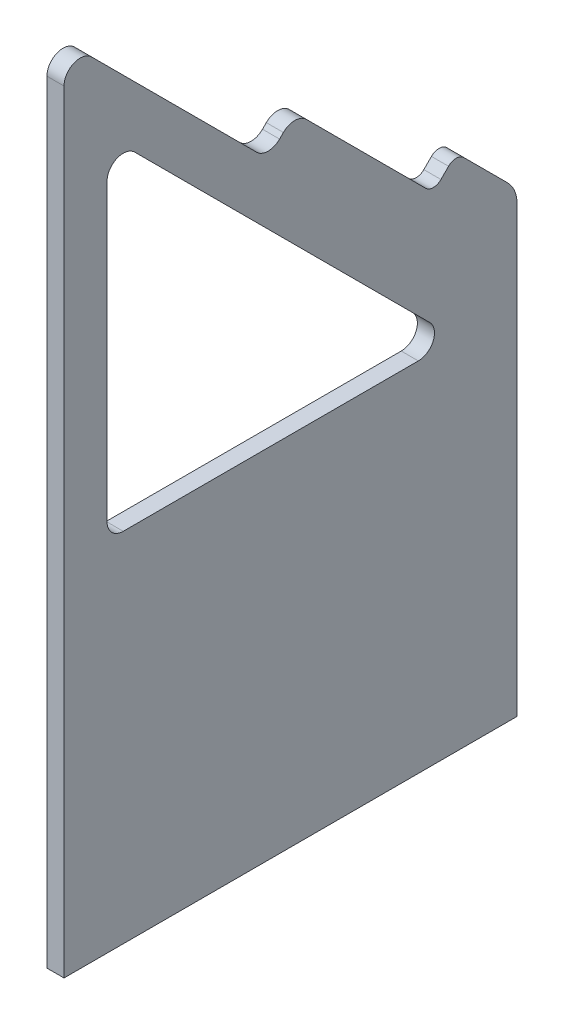
from build123d import *

# Parameters (mm, degrees)
BOSS_EXTRU_1_DEPTH      = 3.175
CONG_1_R                = 6
CONG_2_R                = 2
ENL_V_MAT_EXTRU_2_DEPTH = 157.50531659973907
CONG_4_R                = 3
BOSS_EXTRU_2_DEPTH      = 3.175
CONG_5_R                = 2
CONG_6_R                = 3


with BuildPart() as part:
    # Esquisse1 → Boss.-Extru.1 (new body)
    with BuildSketch(Plane(origin=(0, 0, 0), x_dir=(0, 0, -1), z_dir=(1, 0, 0))):
        Polygon((-42.0728534805994, 0), (42.0728534805994, 0), (42.072853480599385, 84.94974746830529), (30.759144981614714, 96.26345596728963), (26.516504294495412, 92.02081528017037), (33.58757210636085, 84.94974746830486), (28.637824638054987, 79.99999999999906), (-42.07285348059938, 150.71067811865416), align=None)
    extrude(amount=BOSS_EXTRU_1_DEPTH)

    # Congé1
    cong_1_edges = [part.edges().sort_by_distance(p)[0] for p in [
        (1.5875, 84.94974746830529, -42.072853480599385),
    ]]
    fillet(cong_1_edges, radius=CONG_1_R)

    # Congé2
    cong_2_edges = [part.edges().sort_by_distance(p)[0] for p in [
        (1.5875, 92.02081528017037, -26.516504294495412),
        (1.5875, 96.26345596728963, -30.759144981614714),
    ]]
    fillet(cong_2_edges, radius=CONG_2_R)

    # Esquisse4 → Enlèv. mat.-Extru.2 (cut, through all)
    with BuildSketch(Plane(origin=(3.175, 0, 0), x_dir=(0, 0, -1), z_dir=(1, 0, 0))):
        Polygon((30.974116139400625, 66.34999999966868), (-34.07285348059938, 66.34999999966868), (-34.07285348059938, 131.39696961966868), align=None)
    extrude(amount=-ENL_V_MAT_EXTRU_2_DEPTH, mode=Mode.SUBTRACT)

    # Congé4
    cong_4_edges = [part.edges().sort_by_distance(p)[0] for p in [
        (1.5875, 150.71067811865416, 42.07285348059938),
        (1.5875, 131.39696961966868, 34.07285348059938),
        (1.5875, 66.34999999966868, -30.974116139400625),
        (1.5875, 66.34999999966868, 34.07285348059938),
    ]]
    fillet(cong_4_edges, radius=CONG_4_R)

    # Esquisse5 → Boss.-Extru.2 (add)
    with BuildSketch(Plane(origin=(3.175, 0, 0), x_dir=(0, 0, -1), z_dir=(1, 0, 0))):
        Polygon((30.759144981614842, 96.26345596728976), (26.51650429449542, 92.02081528017034), (0.7928932188133107, 117.74442635585244), (-4.15685424949237, 112.79467888754677), (28.637824638054987, 79.99999999999906), (37.8302127934801, 89.19238815542445), align=None)
    extrude(amount=-BOSS_EXTRU_2_DEPTH)

    # Congé5
    cong_5_edges = [part.edges().sort_by_distance(p)[0] for p in [
        (1.5875, 96.26345596728976, -30.759144981614842),
        (1.5875, 92.02081528017034, -26.51650429449542),
    ]]
    fillet(cong_5_edges, radius=CONG_5_R)

    # Congé6
    cong_6_edges = [part.edges().sort_by_distance(p)[0] for p in [
        (1.5875, 112.79467888754677, 4.15685424949237),
        (1.5875, 117.74442635585244, -0.7928932188133107),
    ]]
    fillet(cong_6_edges, radius=CONG_6_R)


solid = part.part
